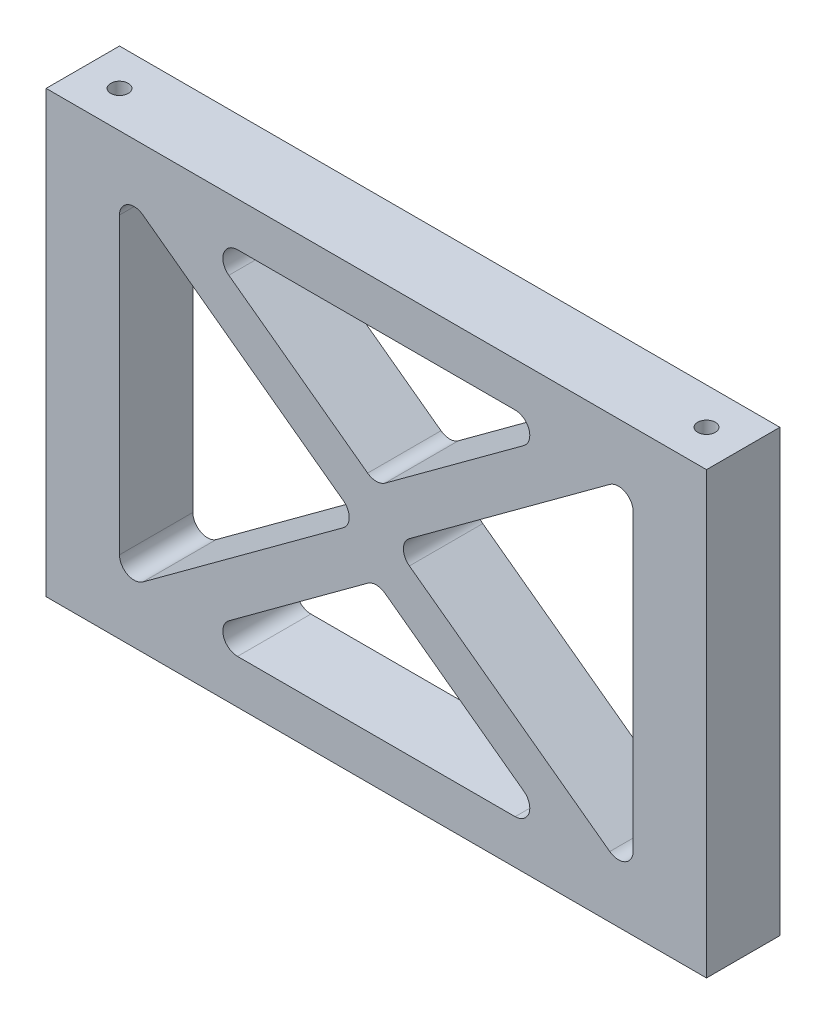
from build123d import *

# Parameters (mm, degrees)
SKIZZE1_W                       = 90
SKIZZE1_H                       = 60
AUFSATZ_LINEAR_AUSTRAGEN1_DEPTH = 10
SCHNITT_LINEAR_AUSTRAGEN1_DEPTH = 10
SKIZZE3_R                       = 1.2
SCHNITT_LINEAR_AUSTRAGEN2_DEPTH = 84


with BuildPart() as part:
    # Skizze1 → Aufsatz-Linear austragen1 (new body)
    with BuildSketch(Plane.XY):
        with Locations((45, 30)):
            Rectangle(SKIZZE1_W, SKIZZE1_H)
    extrude(amount=AUFSATZ_LINEAR_AUSTRAGEN1_DEPTH)

    # Skizze2 → Schnitt-Linear austragen1 (cut)
    with BuildSketch(Plane.XY.offset(10)):
        with BuildLine():
            Line((10, 50.05034464), (10, 9.94965536))
            ThreePointArc((10, 9.94965536), (11.096486968, 8.165372815), (13.183664201, 8.337532828))
            Line((13.183664201, 8.337532828), (40.491757454, 28.387877468))
            ThreePointArc((40.491757454, 28.387877468), (41.308093253, 30), (40.491757454, 31.612122532))
            Line((40.491757454, 31.612122532), (13.183664201, 51.662467172))
            ThreePointArc((13.183664201, 51.662467172), (11.096486968, 51.834627185), (10, 50.05034464))
        make_face()
        with BuildLine():
            Line((43.816335799, 36.499330073), (24.900464067, 50.387877468))
            ThreePointArc((24.900464067, 50.387877468), (24.183569789, 52.622798095), (26.084128268, 54))
            Line((26.084128268, 54), (63.915871732, 54))
            ThreePointArc((63.915871732, 54), (65.816430211, 52.622798095), (65.099535933, 50.387877468))
            Line((65.099535933, 50.387877468), (46.183664201, 36.499330073))
            ThreePointArc((46.183664201, 36.499330073), (45, 36.111452606), (43.816335799, 36.499330073))
        make_face()
        with BuildLine():
            Line((26.084128268, 6), (63.915871732, 6))
            ThreePointArc((63.915871732, 6), (65.816430211, 7.377201905), (65.099535933, 9.612122532))
            Line((65.099535933, 9.612122532), (46.183664201, 23.500669927))
            ThreePointArc((46.183664201, 23.500669927), (45, 23.888547394), (43.816335799, 23.500669927))
            Line((43.816335799, 23.500669927), (24.900464067, 9.612122532))
            ThreePointArc((24.900464067, 9.612122532), (24.183569789, 7.377201905), (26.084128268, 6))
        make_face()
        with BuildLine():
            Line((80, 50.05034464), (80, 9.94965536))
            ThreePointArc((80, 9.94965536), (78.903513032, 8.165372815), (76.816335799, 8.337532828))
            Line((76.816335799, 8.337532828), (49.508242546, 28.387877468))
            ThreePointArc((49.508242546, 28.387877468), (48.691906747, 30), (49.508242546, 31.612122532))
            Line((49.508242546, 31.612122532), (76.816335799, 51.662467172))
            ThreePointArc((76.816335799, 51.662467172), (78.903513032, 51.834627185), (80, 50.05034464))
        make_face()
    extrude(amount=-SCHNITT_LINEAR_AUSTRAGEN1_DEPTH, mode=Mode.SUBTRACT)

    # Skizze3 → Schnitt-Linear austragen2 (cut)
    with BuildSketch(Plane(origin=(0, 60, 0), x_dir=(1, 0, 0), z_dir=(0, 1, 0))):
        with Locations(Location((5, -5, 0), (0, 0, 270))):
            Circle(SKIZZE3_R)
        with Locations(Location((85, -5, 0), (0, 0, 270))):
            Circle(SKIZZE3_R)
    extrude(amount=-SCHNITT_LINEAR_AUSTRAGEN2_DEPTH, mode=Mode.SUBTRACT)


solid = part.part
